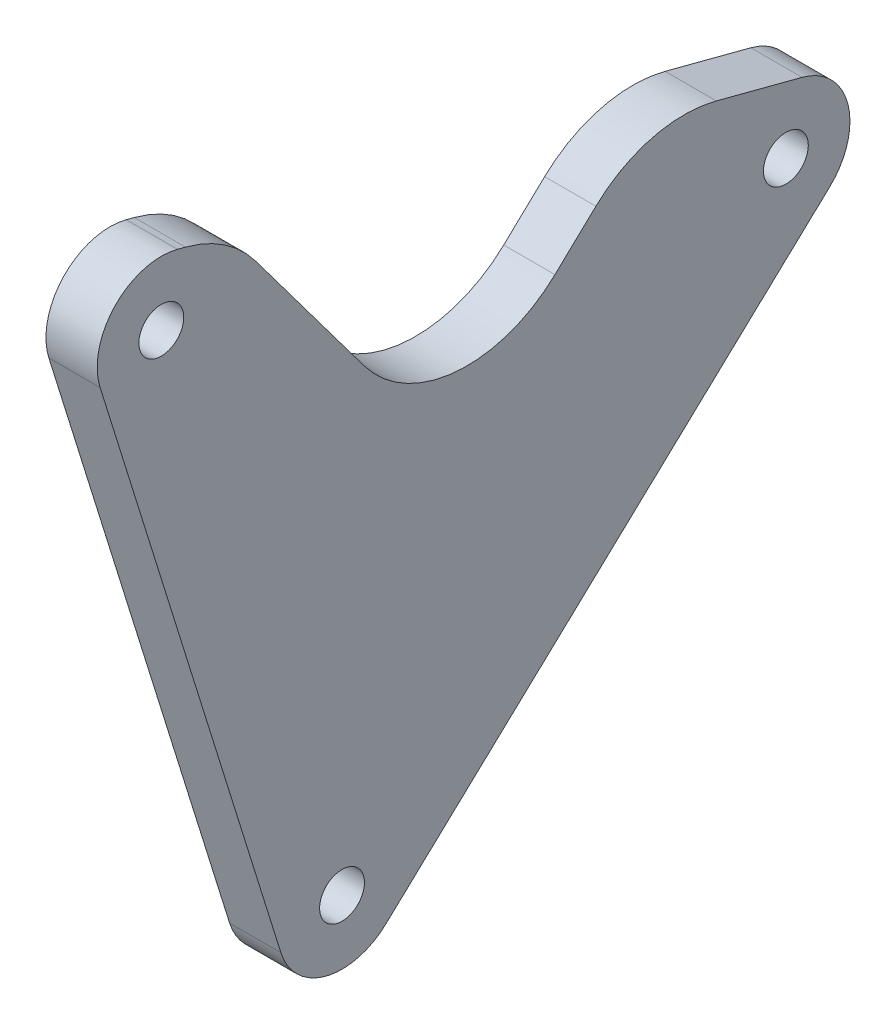
from build123d import *

# Parameters (mm, degrees)
SCHIZZO2_R                   = 3.5
ESTRUSIONE_ESTRUSIONE1_DEPTH = 8


with BuildPart() as part:
    # Schizzo2 → Estrusione-Estrusione1 (new body)
    with BuildSketch(Plane(origin=(0, 0, 0), x_dir=(0, 0, -1), z_dir=(1, 0, 0))):
        with BuildLine():
            Line((17.443402623, -4.562120686), (18.692856186, -4.888900849))
            ThreePointArc((18.692856186, -4.888900849), (24.793396334, -7.641998704), (29.6440016, -12.25369757))
            Line((29.6440016, -12.25369757), (46.600035601, -34.907756452))
            ThreePointArc((46.600035601, -34.907756452), (60.913978484, -42.85118293), (76.365363597, -37.443624966))
            Line((76.365363597, -37.443624966), (82.753482475, -31.392779069))
            ThreePointArc((82.753482475, -31.392779069), (91.534986316, -26.540938387), (101.567665057, -26.563850861))
            Line((101.567665057, -26.563850861), (114.943402623, -30.062120686))
            ThreePointArc((114.943402623, -30.062120686), (122.105106749, -37.2738887), (119.255032306, -47.029742304))
            Line((119.255032306, -47.029742304), (49.969227683, -112.029742304))
            ThreePointArc((49.969227683, -112.029742304), (40.580232317, -114.406888859), (33.580509124, -107.713015918))
            Line((33.580509124, -107.713015918), (5.366313747, -17.213015918))
            ThreePointArc((5.366313747, -17.213015918), (7.679922234, -7.331584183), (17.443402623, -4.562120686))
        make_face()
        with Locations((14.913125179, -14.236710913)):
            Circle(SCHIZZO2_R, mode=Mode.SUBTRACT)
        with Locations((112.413125179, -39.736710913)):
            Circle(SCHIZZO2_R, mode=Mode.SUBTRACT)
        with Locations((43.127320556, -104.736710913)):
            Circle(SCHIZZO2_R, mode=Mode.SUBTRACT)
    extrude(amount=ESTRUSIONE_ESTRUSIONE1_DEPTH)


solid = part.part
